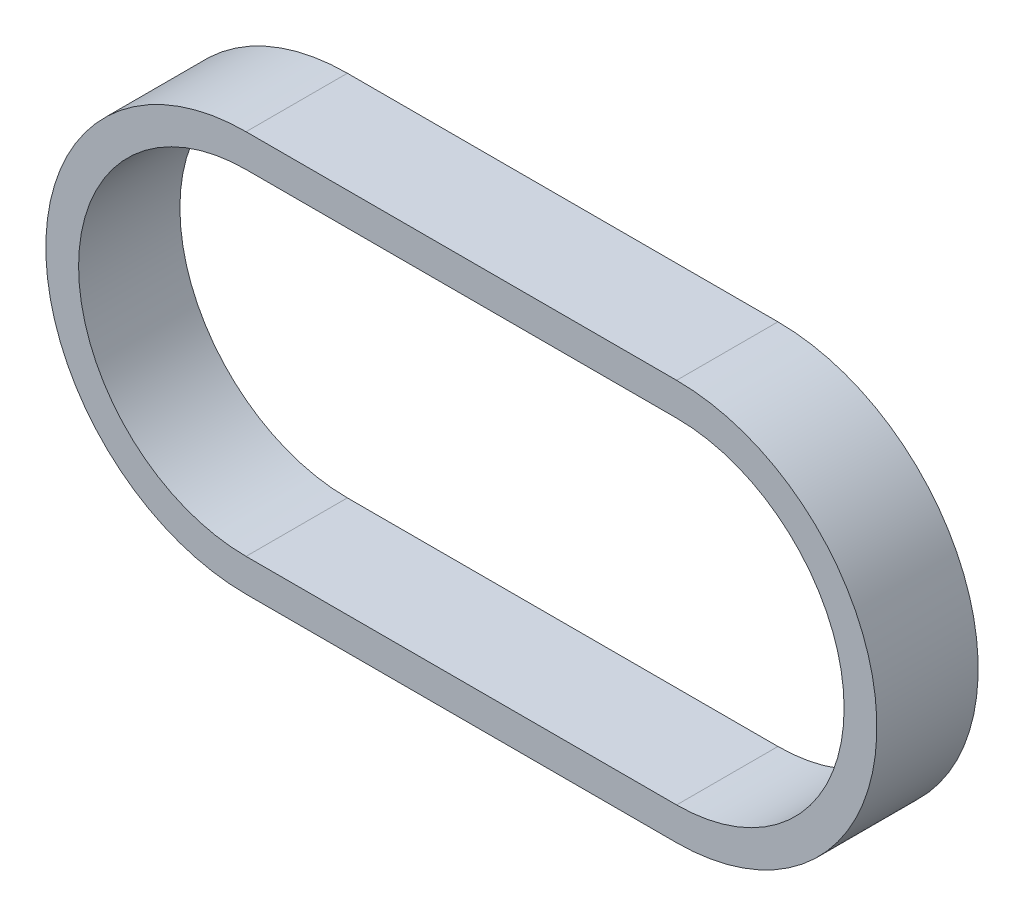
from build123d import *

# Parameters (mm, degrees)
BOSS_EXTRU_1_DEPTH = 3


with BuildPart() as part:
    # Esquisse1 → Boss.-Extru.1 (new, symmetric)
    # profile 1 of 2: a face of its own
    with BuildSketch(Plane.XY):
        with BuildLine():
            Line((0, 11.86), (25.5, 11.86))
            ThreePointArc((25.5, 11.86), (37.36, 0), (25.5, -11.86))
            Line((25.5, -11.86), (0, -11.86))
            ThreePointArc((0, -11.86), (-11.86, 0), (0, 11.86))
        make_face()
        with BuildLine():
            ThreePointArc((25.5, -11.46), (36.96, 0), (25.5, 11.46))
            Line((25.5, 11.46), (0, 11.46))
            ThreePointArc((0, 11.46), (-11.46, 0), (0, -11.46))
            Line((0, -11.46), (25.5, -11.46))
        make_face(mode=Mode.SUBTRACT)
    # profile 2 of 2: a face of its own
    with BuildSketch(Plane.XY):
        with BuildLine():
            Line((0, -11.46), (25.5, -11.46))
            ThreePointArc((25.5, -11.46), (36.96, 0), (25.5, 11.46))
            Line((25.5, 11.46), (0, 11.46))
            ThreePointArc((0, 11.46), (-11.46, 0), (0, -11.46))
        make_face()
        with BuildLine():
            ThreePointArc((0, 9.92), (-9.92, 0), (0, -9.92))
            Line((0, -9.92), (25.5, -9.92))
            ThreePointArc((25.5, -9.92), (35.42, 0), (25.5, 9.92))
            Line((25.5, 9.92), (0, 9.92))
        make_face(mode=Mode.SUBTRACT)
    extrude(amount=BOSS_EXTRU_1_DEPTH, both=True)


solid = part.part
